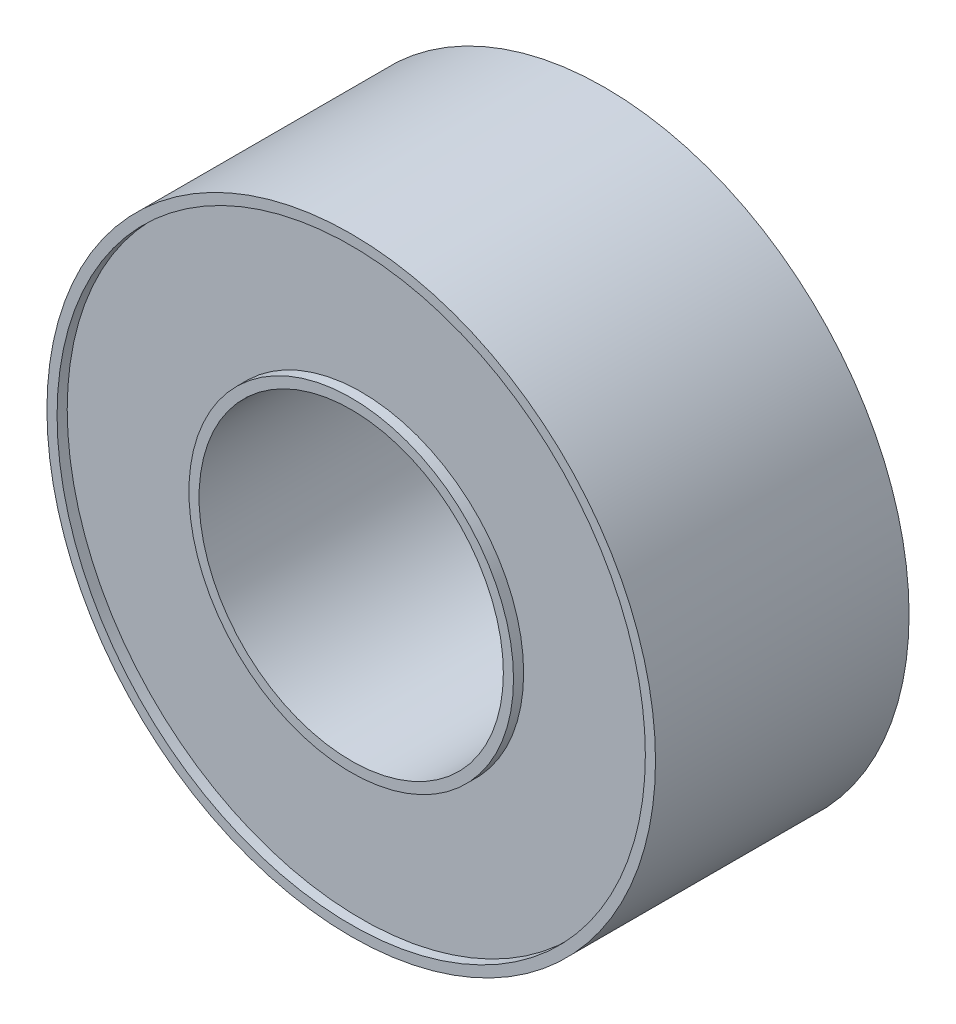
from build123d import *

# Parameters (mm, degrees)
CROQUIS1_R                = 1.6
CROQUIS1_R_2              = 1.5
SALIENTE_EXTRUIR1_DEPTH   = 2.5
CROQUIS1_R_3              = 3
CROQUIS1_R_4              = 2.9
SALIENTE_EXTRUIR1_2_DEPTH = 2.5
CROQUIS2_R                = 2.9
CROQUIS2_R_2              = 1.6
SALIENTE_EXTRUIR4_DEPTH   = 2.4
CROQUIS3_R                = 2.9
CROQUIS3_R_2              = 1.6
CORTAR_EXTRUIR1_DEPTH     = 0.1


with BuildPart() as part:
    # Croquis1 → Saliente-Extruir1 (new body)
    with BuildSketch(Plane.XY):
        Circle(CROQUIS1_R)
        Circle(CROQUIS1_R_2, mode=Mode.SUBTRACT)
    extrude(amount=SALIENTE_EXTRUIR1_DEPTH)



with BuildPart() as body_2:
    # Croquis1 → Saliente-Extruir1 2 (new body)
    with BuildSketch(Plane.XY):
        Circle(CROQUIS1_R_3)
        Circle(CROQUIS1_R_4, mode=Mode.SUBTRACT)
    extrude(amount=SALIENTE_EXTRUIR1_2_DEPTH)


with BuildPart() as part_1:
    add(part.part)

    add(body_2.part)  # Saliente-Extruir4 merges body 2
    # Croquis2 → Saliente-Extruir4 (add)
    with BuildSketch(Plane.XY):
        Circle(CROQUIS2_R)
        Circle(CROQUIS2_R_2, mode=Mode.SUBTRACT)
    extrude(amount=SALIENTE_EXTRUIR4_DEPTH)

    # Croquis3 → Cortar-Extruir1 (cut)
    with BuildSketch(Plane(origin=(0, 0, 0), x_dir=(-1, 0, 0), z_dir=(0, 0, -1))):
        with Locations(Location((0, 0, 0), (0, 0, 180))):
            Circle(CROQUIS3_R)
        with Locations(Location((0, 0, 0), (0, 0, 180))):
            Circle(CROQUIS3_R_2, mode=Mode.SUBTRACT)
    extrude(amount=-CORTAR_EXTRUIR1_DEPTH, mode=Mode.SUBTRACT)


solid = part_1.part
